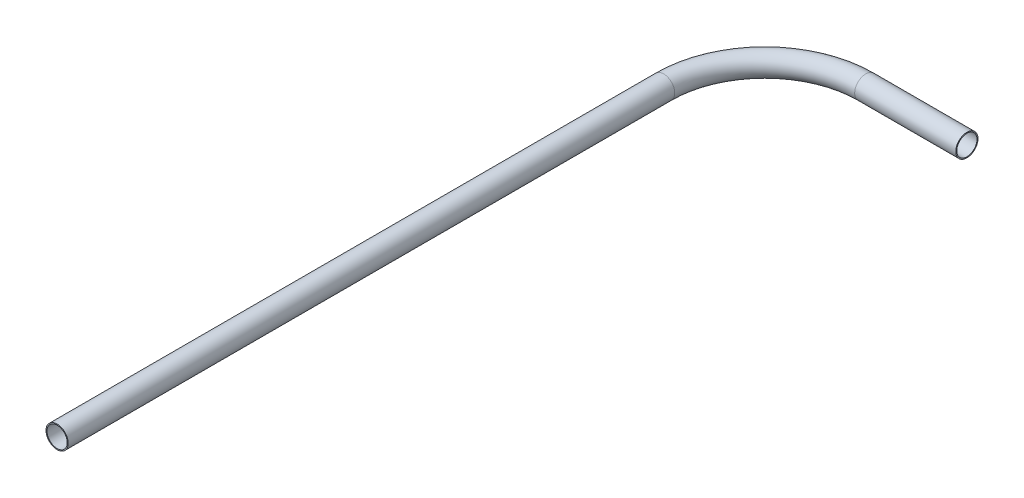
from build123d import *

# Parameters (mm, degrees)
SKETCH4_R   = 2.794
SKETCH4_R_2 = 2.54


with BuildPart() as part:
    # Sweep-Thin1: sweep along a path in Sketch2
    with BuildLine(Plane(origin=(0, 0, 0), x_dir=(1, 0, 0), z_dir=(0, 1, 0))) as sweep_thin1_path:
        Line((0, 0), (0, 152.4))
        ThreePointArc((0, 152.4), (7.439487758, 170.360512242), (25.4, 177.8))
        Line((25.4, 177.8), (50.8, 177.8))
    # Sketch4 → Sweep-Thin1 (sweep)
    with BuildSketch(Plane.XY):
        Circle(SKETCH4_R)
        Circle(SKETCH4_R_2, mode=Mode.SUBTRACT)
    sweep(path=sweep_thin1_path.line)


solid = part.part
